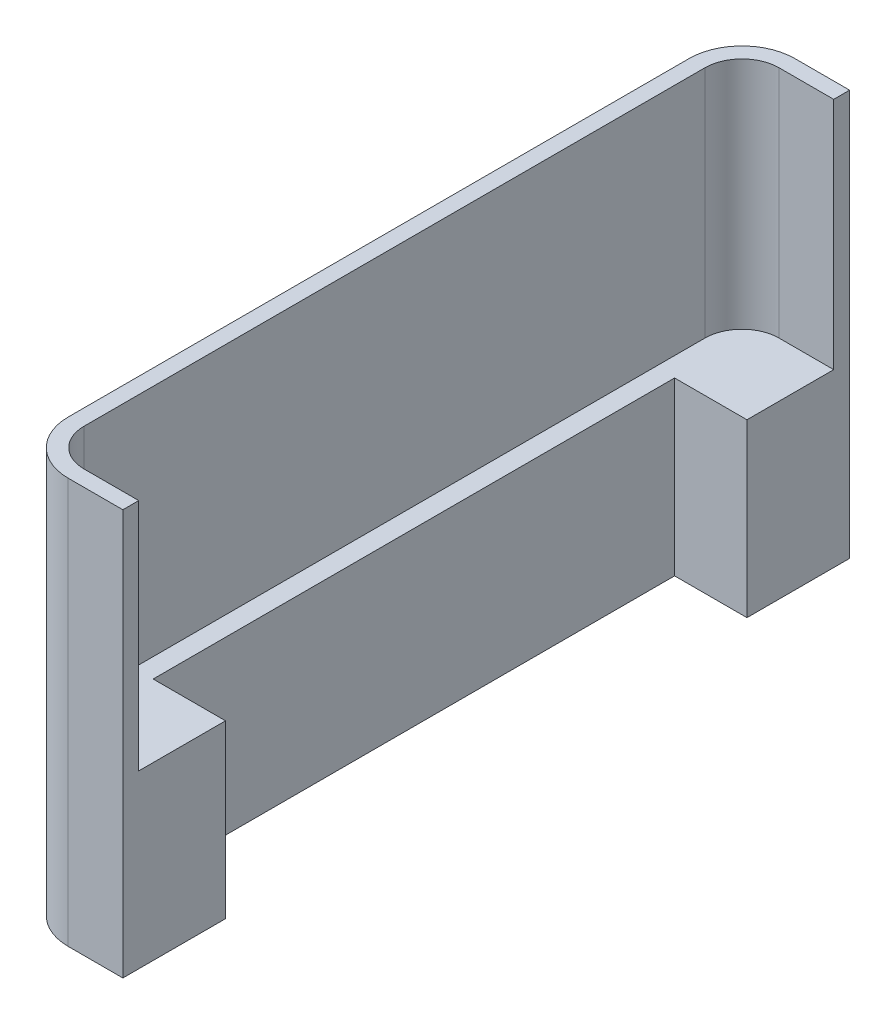
from build123d import *

# Parameters (mm, degrees)
SKETCH2_W           = 5.08
SKETCH2_H           = 34.3
BOSS_EXTRUDE1_DEPTH = 19.1389
FILLET1_R           = 2.5
SKETCH3_W           = 3.415
SKETCH3_H           = 24.61
CUT_EXTRUDE1_DEPTH  = 55.558231654
CUT_EXTRUDE2_DEPTH  = 11.0489


with BuildPart() as part:
    # Sketch2 → Boss-Extrude1 (new body)
    with BuildSketch(Plane(origin=(0, 1.61, 0), x_dir=(1, 0, 0), z_dir=(0, 1, 0))):
        with Locations((-45.595, 6.035)):
            Rectangle(SKETCH2_W, SKETCH2_H)
    extrude(amount=BOSS_EXTRUDE1_DEPTH)

    # Fillet1
    fillet1_edges = [part.edges().sort_by_distance(p)[0] for p in [
        (-48.135, 11.17945, -23.185),
        (-48.135, 11.17945, 11.115),
    ]]
    fillet(fillet1_edges, radius=FILLET1_R)

    # Sketch3 → Cut-Extrude1 (cut, through all)
    with BuildSketch(Plane(origin=(0, 9.7, 0), x_dir=(-1, 0, 0), z_dir=(0, -1, 0))):
        with Locations((44.7625, 6.035)):
            Rectangle(SKETCH3_W, SKETCH3_H)
    extrude(amount=CUT_EXTRUDE1_DEPTH, mode=Mode.SUBTRACT)

    # Sketch4 → Cut-Extrude2 (cut)
    with BuildSketch(Plane(origin=(0, 20.7489, 0), x_dir=(1, 0, 0), z_dir=(0, 1, 0))):
        with BuildLine():
            Line((-43.055, -10.365), (-43.055, 22.435))
            Line((-43.055, 22.435), (-45.635, 22.435))
            ThreePointArc((-45.635, 22.435), (-46.872436867, 21.922436867), (-47.385, 20.685))
            Line((-47.385, 20.685), (-47.385, -8.615))
            ThreePointArc((-47.385, -8.615), (-46.872436867, -9.852436867), (-45.635, -10.365))
            Line((-45.635, -10.365), (-43.055, -10.365))
        make_face()
    extrude(amount=-CUT_EXTRUDE2_DEPTH, mode=Mode.SUBTRACT)


solid = part.part
